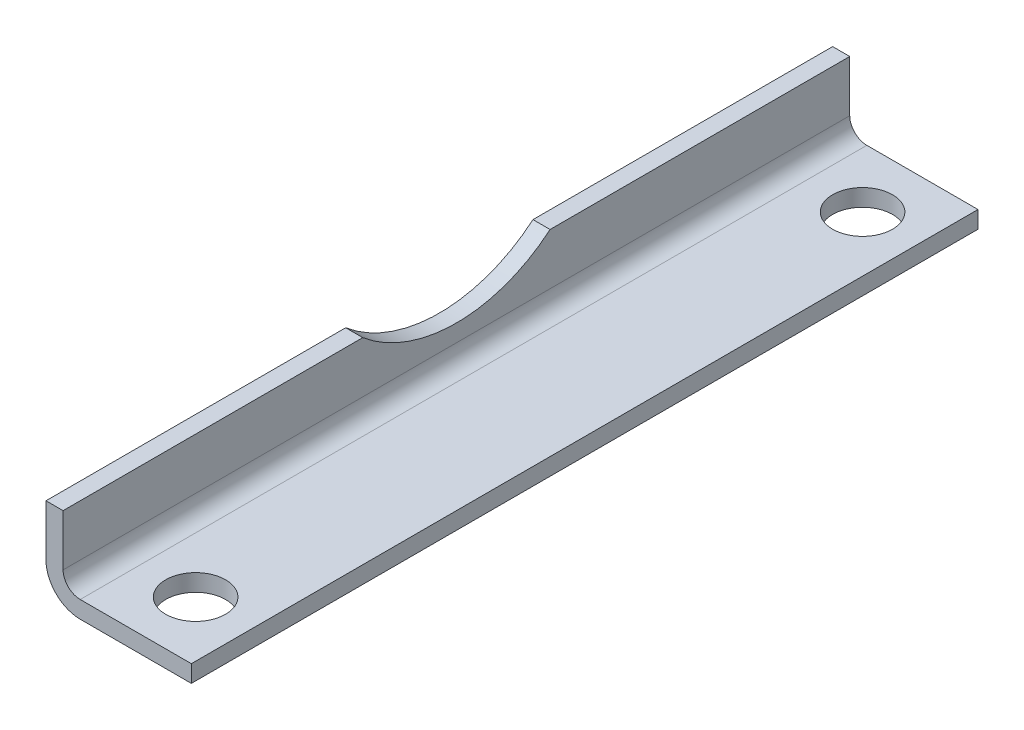
from build123d import *

# Parameters (mm, degrees)
EXTRUDE_1_DEPTH     = 46
FILLET_1_R          = 4
FILLET_2_R          = 2
SKETCH_2_R          = 3.5
CUT_EXTRUDE_1_DEPTH = 10
SKETCH_3_R          = 17
CUT_EXTRUDE_2_DEPTH = 10


with BuildPart() as part:
    # 草图1 → 凸台-拉伸1 (new, symmetric)
    with BuildSketch(Plane.XY):
        Polygon((0, 0), (0, 10), (2, 10), (2, 2), (17, 2), (17, 0), align=None)
    extrude(amount=EXTRUDE_1_DEPTH, both=True)

    # 圆角1
    fillet_1_edges = [part.edges().sort_by_distance(p)[0] for p in [
        (0, 0, 0),
    ]]
    fillet(fillet_1_edges, radius=FILLET_1_R)

    # 圆角2
    fillet_2_edges = [part.edges().sort_by_distance(p)[0] for p in [
        (2, 2, 0),
    ]]
    fillet(fillet_2_edges, radius=FILLET_2_R)

    # 草图2 → 切除-拉伸1 (cut)
    with BuildSketch(Plane.XZ):
        with Locations(Location((10.5, 39, 0), (0, 0, 270))):
            Circle(SKETCH_2_R)
        with Locations((10.5, -39)):
            Circle(SKETCH_2_R)
    extrude(amount=-CUT_EXTRUDE_1_DEPTH, mode=Mode.SUBTRACT)

    # 草图3 → 切除-拉伸2 (cut)
    with BuildSketch(Plane.ZY):
        with Locations((0, 23)):
            Circle(SKETCH_3_R)
    extrude(amount=-CUT_EXTRUDE_2_DEPTH, mode=Mode.SUBTRACT)


solid = part.part
